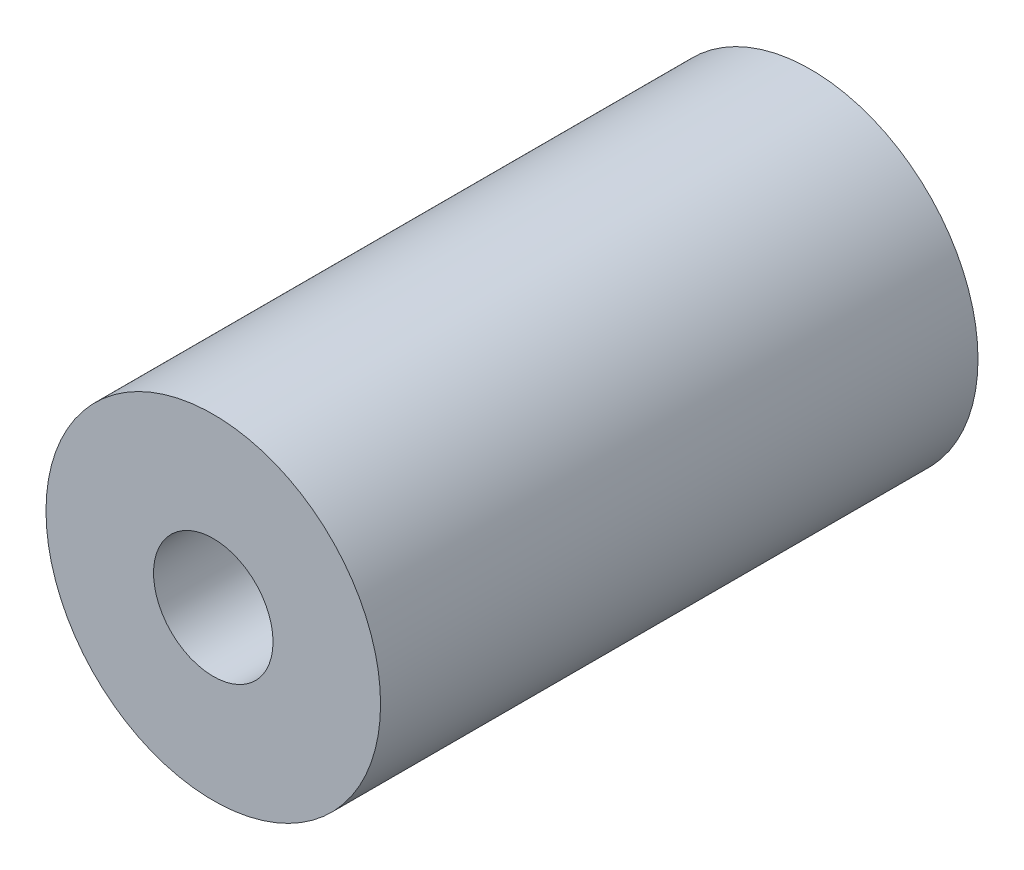
from build123d import *

# Parameters (mm, degrees)
SKETCH_1_R      = 7
SKETCH_1_R_2    = 2.5
EXTRUDE_1_DEPTH = 25


with BuildPart() as part:
    # 草图1 → 凸台-拉伸1 (new body)
    with BuildSketch(Plane.XY):
        Circle(SKETCH_1_R)
        Circle(SKETCH_1_R_2, mode=Mode.SUBTRACT)
    extrude(amount=EXTRUDE_1_DEPTH)


solid = part.part
